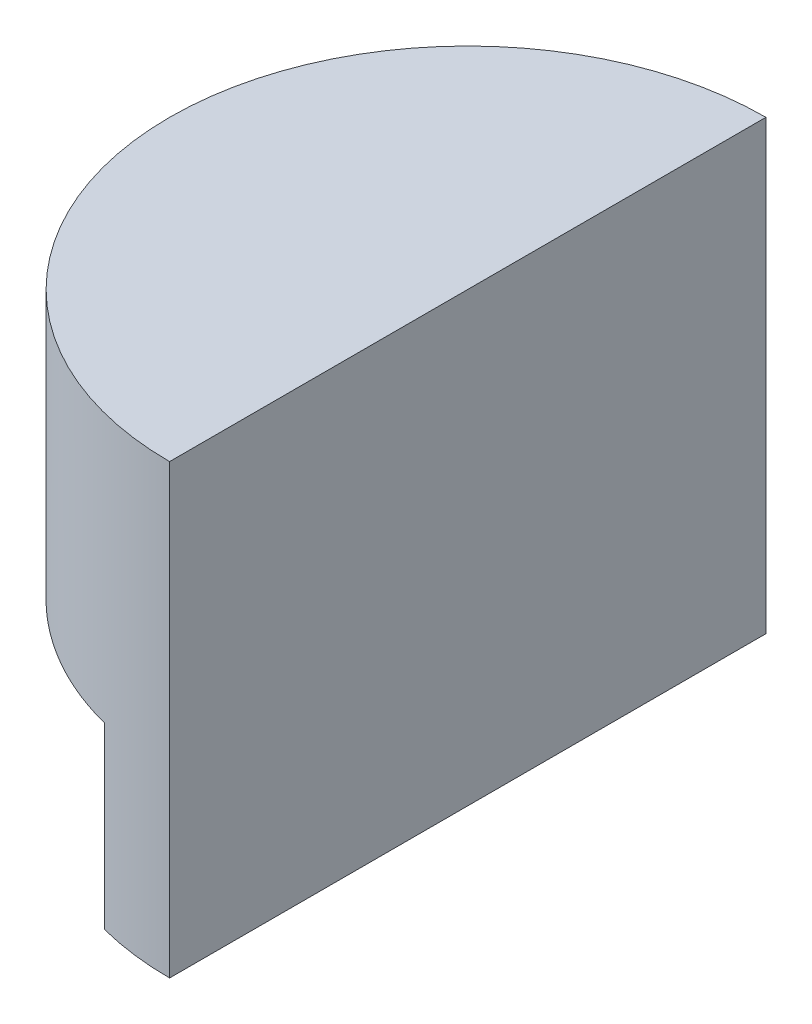
from build123d import *

# Parameters (mm, degrees)
SALIENTE_EXTRUIR1_DEPTH = 15
CROQUIS2_W              = 7.5
CROQUIS2_H              = 6
CORTAR_EXTRUIR2_DEPTH   = 27.925824036
CROQUIS4_R              = 2.5
SALIENTE_EXTRUIR2_DEPTH = 6


with BuildPart() as part:
    # Croquis1 → Saliente-Extruir1 (new body)
    with BuildSketch(Plane(origin=(0, 0, 0), x_dir=(1, 0, 0), z_dir=(0, 1, 0))):
        with BuildLine():
            Line((0, 10), (0, -10))
            ThreePointArc((0, -10), (-10, 0), (0, 10))
        make_face()
    extrude(amount=SALIENTE_EXTRUIR1_DEPTH)

    # Croquis2 → Cortar-Extruir2 (cut, through all)
    with BuildSketch(Plane.XY.offset(10)):
        with Locations((-6.25, 3)):
            Rectangle(CROQUIS2_W, CROQUIS2_H)
    extrude(amount=-CORTAR_EXTRUIR2_DEPTH, mode=Mode.SUBTRACT)

    # Croquis4 → Saliente-Extruir2 (add)
    with BuildSketch(Plane.XZ.offset(-6)):
        with Locations(Location((-7.5, 0, 0), (0, 0, 179.999408267))):
            Circle(CROQUIS4_R)
    extrude(amount=SALIENTE_EXTRUIR2_DEPTH)


solid = part.part
